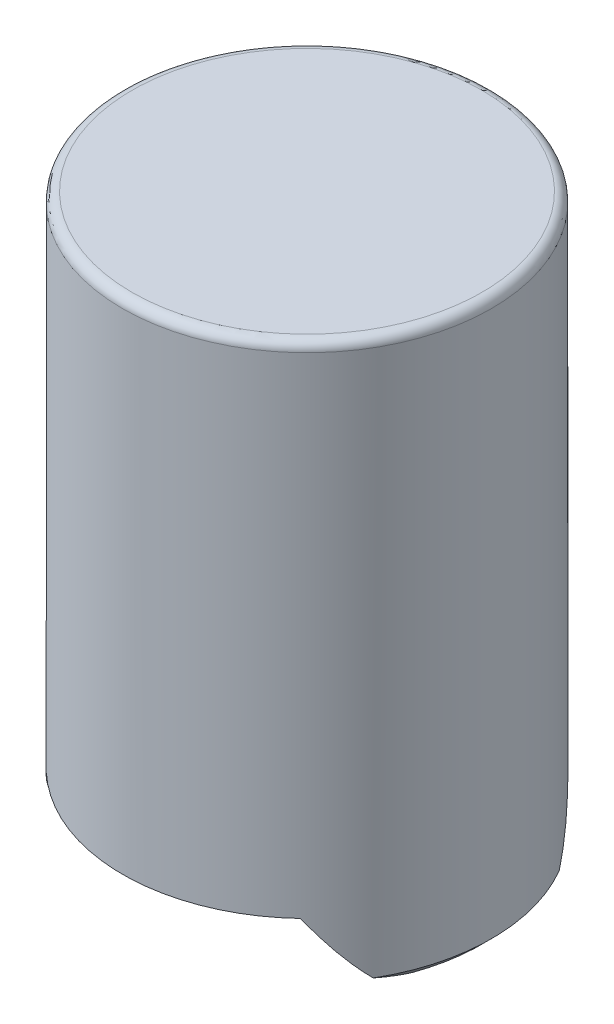
from build123d import *

# Parameters (mm, degrees)
SKETCH_1_R               = 9.8
EXTRUDE_1_DEPTH          = 30
FILLET_1_R               = 0.5
CUT_EXTRUDE_1_DEPTH      = 34.046633746
CUT_EXTRUDE_1_DEPTH_BACK = 34.046633746
CUT_EXTRUDE_START        = -2
SKETCH_5_R               = 8
CUT_EXTRUDE_2_DEPTH      = 23
CHAMFER_1_SIZE           = 0.5
SKETCH_7_R               = 1.5
CUT_EXTRUDE_4_DEPTH      = 7
SKETCH_9_R               = 3
SKETCH_9_R_2             = 1.5
EXTRUDE_2_DEPTH          = 7
CHAMFER_2_SIZE           = 0.5


with BuildPart() as part:
    # 草图1 → 凸台-拉伸1 (new body)
    with BuildSketch(Plane(origin=(0, 0, 0), x_dir=(1, 0, 0), z_dir=(0, 1, 0))):
        Circle(SKETCH_1_R)
    extrude(amount=EXTRUDE_1_DEPTH)

    # 圆角1
    fillet_1_edges = [part.edges().sort_by_distance(p)[0] for p in [
        (-9.8, 30, 0),
    ]]
    fillet(fillet_1_edges, radius=FILLET_1_R)

    # 草图4 → 切除-拉伸1 (cut, two sides: drawn at the far end of the back side and taken through both)
    with BuildSketch(Plane.XY.offset(-CUT_EXTRUDE_1_DEPTH_BACK)):
        Polygon((6.75, 3.464101615), (-6.75, 3.464101615), (-8.75, 0), (8.75, 0), align=None)
    extrude(amount=CUT_EXTRUDE_1_DEPTH + CUT_EXTRUDE_1_DEPTH_BACK, mode=Mode.SUBTRACT)

    # 草图5 → 切除-拉伸2 (cut)
    with BuildSketch(Plane.XZ.offset(-3.464101615).offset(CUT_EXTRUDE_START)):
        Circle(SKETCH_5_R)
    extrude(amount=-CUT_EXTRUDE_2_DEPTH, mode=Mode.SUBTRACT)

    # 倒角1
    chamfer_1_edges = [part.edges().sort_by_distance(p)[0] for p in [
        (-9.8, 0, 0),
        (9.53388693, 0, 2.268259244),
    ]]
    chamfer(chamfer_1_edges, length=CHAMFER_1_SIZE)

    # 草图7 → 切除-拉伸4 (cut)
    with BuildSketch(Plane.XZ.offset(-3.464101615)):
        Circle(SKETCH_7_R)
    extrude(amount=-CUT_EXTRUDE_4_DEPTH, mode=Mode.SUBTRACT)

    # 草图9 → 凸台-拉伸2 (add)
    with BuildSketch(Plane.XZ.offset(-3.464101615)):
        Circle(SKETCH_9_R)
        Circle(SKETCH_9_R_2, mode=Mode.SUBTRACT)
    extrude(amount=-EXTRUDE_2_DEPTH)

    # 倒角2
    chamfer_2_edges = [part.edges().sort_by_distance(p)[0] for p in [
        (-1.5, 3.464101615, 0),
    ]]
    chamfer(chamfer_2_edges, length=CHAMFER_2_SIZE)


solid = part.part
